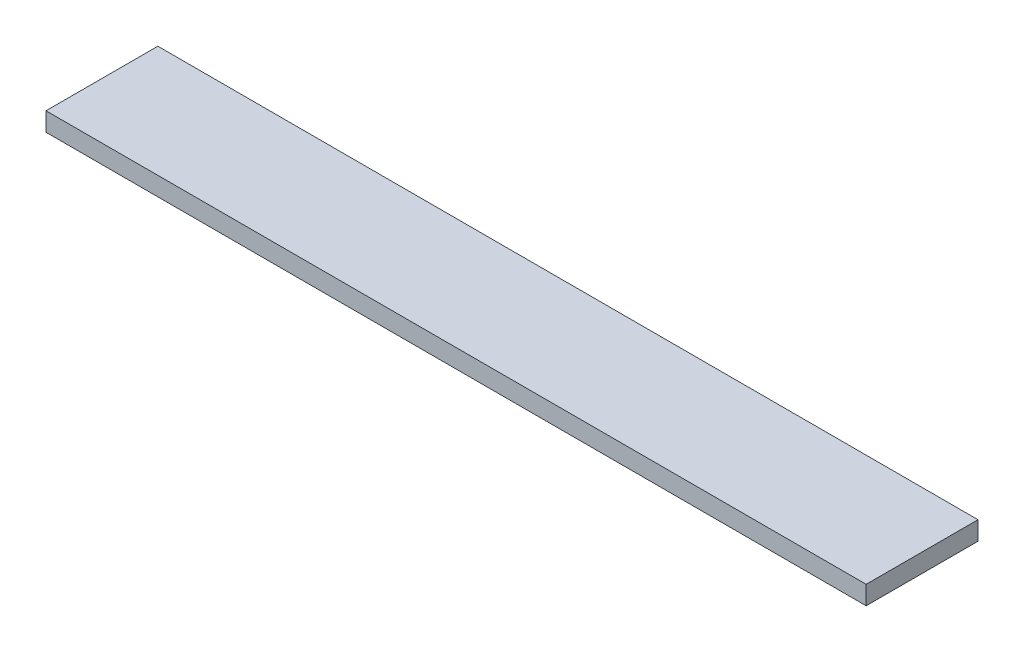
from build123d import *

# Parameters (mm, degrees)
SKETCH1_W           = 2200
SKETCH1_H           = 300
BOSS_EXTRUDE1_DEPTH = 50


with BuildPart() as part:
    # Sketch1 → Boss-Extrude1 (new body)
    with BuildSketch(Plane(origin=(0, 0, 0), x_dir=(1, 0, 0), z_dir=(0, 1, 0))):
        with Locations((1100, 150)):
            Rectangle(SKETCH1_W, SKETCH1_H)
    extrude(amount=BOSS_EXTRUDE1_DEPTH)


solid = part.part
